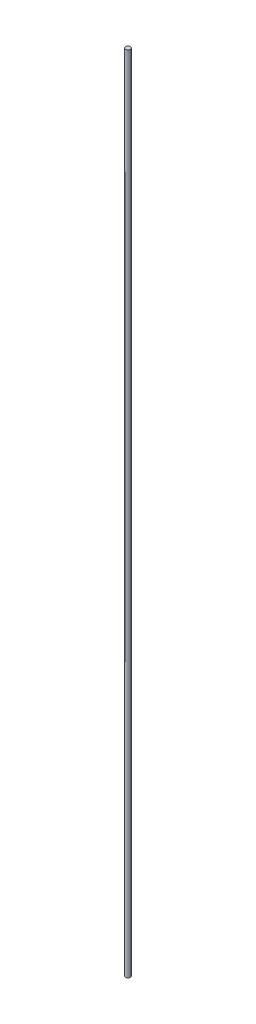
from build123d import *

# Parameters (mm, degrees)
SWEEP1_PROFILE_R = 6.35


with BuildPart() as part:
    # Sweep1: sweep along a path in Sketch1
    with BuildLine(Plane.XY) as sweep1_path:
        Line((0, 0), (0, 2095.246))
    # Sweep1 profile (on start of the path) → Sweep1 (sweep)
    with BuildSketch(Plane.ZX):
        Circle(SWEEP1_PROFILE_R)
    sweep(path=sweep1_path.line)


solid = part.part
